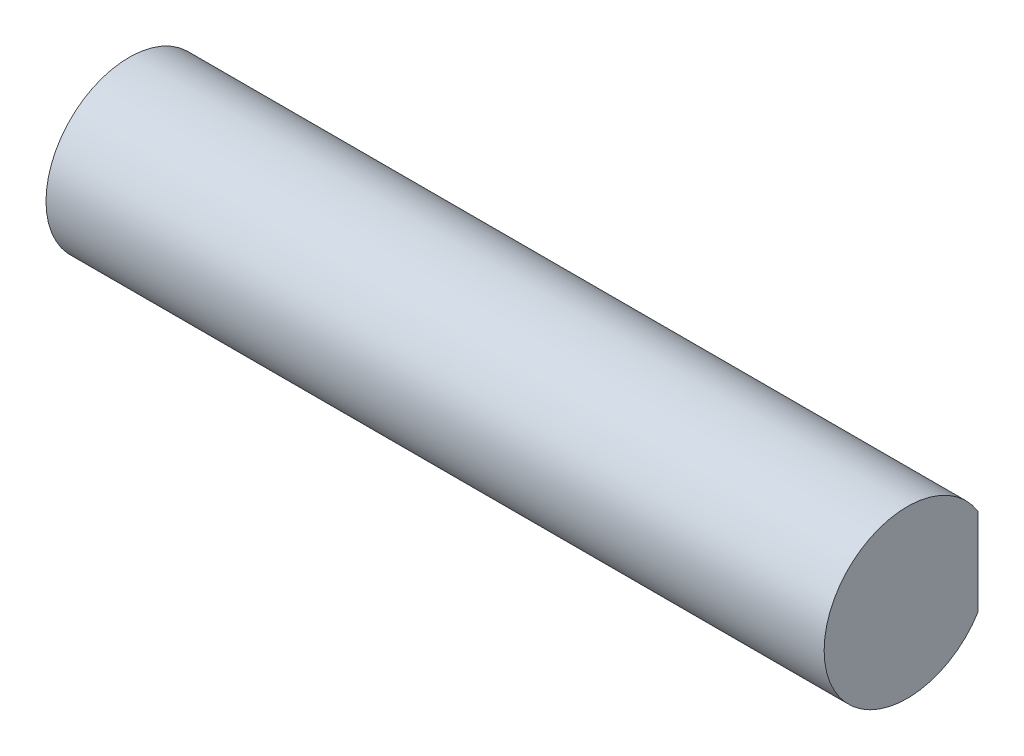
from build123d import *

# Parameters (mm, degrees)
SKETCH1_R           = 2.35
BOSS_EXTRUDE1_DEPTH = 22
CUT_EXTRUDE1_DEPTH  = 22


with BuildPart() as part:
    # Sketch1 → Boss-Extrude1 (new body)
    with BuildSketch(Plane(origin=(0, 0, 0), x_dir=(0, 0, -1), z_dir=(1, 0, 0))):
        Circle(SKETCH1_R)
    extrude(amount=BOSS_EXTRUDE1_DEPTH)

    # Sketch2 → Cut-Extrude1 (cut)
    with BuildSketch(Plane.ZY):
        with BuildLine():
            Line((-2, 1.233896268), (-2, -1.233896268))
            ThreePointArc((-2, -1.233896268), (-2.35, 0), (-2, 1.233896268))
        make_face()
    extrude(amount=-CUT_EXTRUDE1_DEPTH, mode=Mode.SUBTRACT)


solid = part.part
